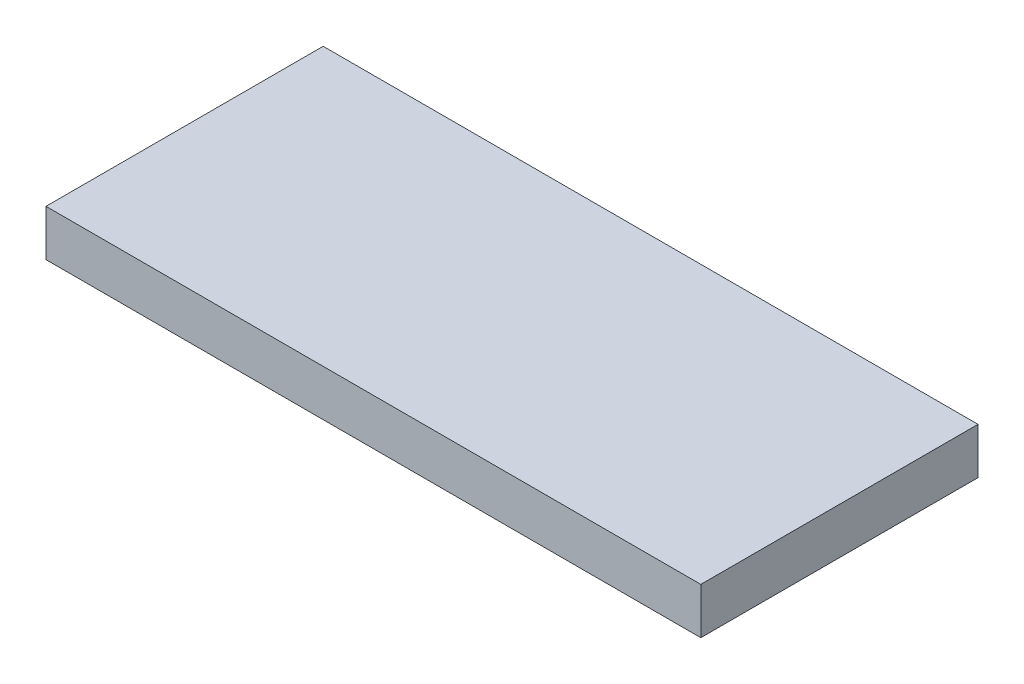
from build123d import *

# Parameters (mm, degrees)
CROQUIS1_W              = 180
CROQUIS1_H              = 12.7
SALIENTE_EXTRUIR1_DEPTH = 76.2


with BuildPart() as part:
    # Croquis1 → Saliente-Extruir1 (new body)
    with BuildSketch(Plane.XY):
        with Locations((90, -6.35)):
            Rectangle(CROQUIS1_W, CROQUIS1_H)
    extrude(amount=SALIENTE_EXTRUIR1_DEPTH)


solid = part.part
